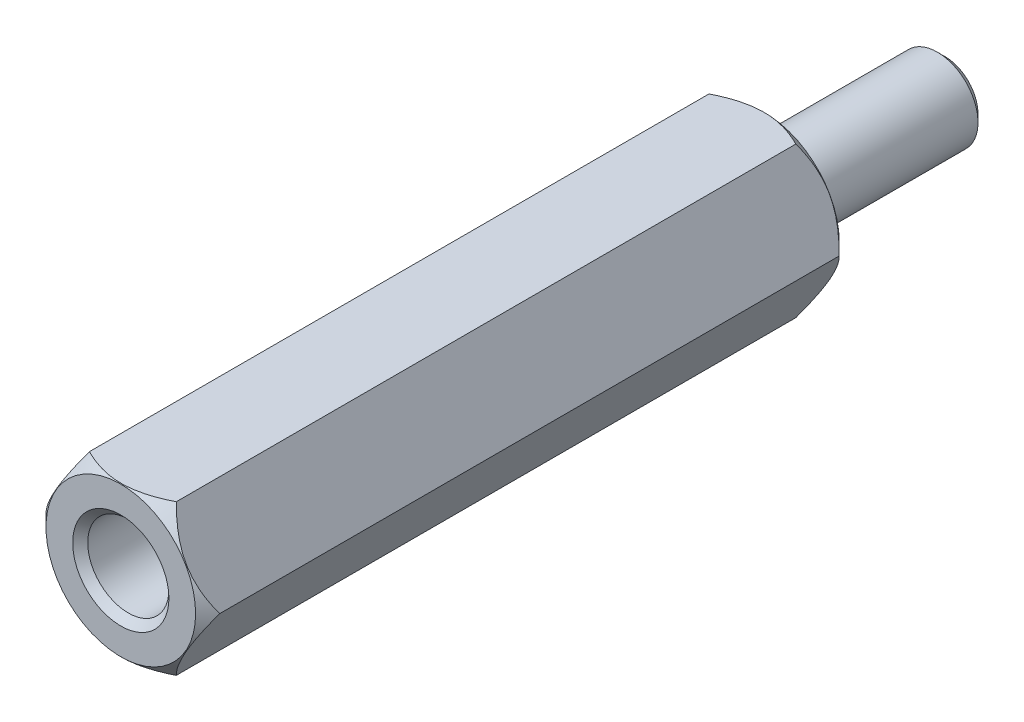
from build123d import *

# Parameters (mm, degrees)
HEX_2_DEPTH                 = 10.7
TAP_DRILL_FOR_M3X0_5_TAP1_D = 2.7
THREAD_DEPTH                = 6
THREAD_DEPTH_BACK           = 2
SKETCH8_R                   = 1.35
INNERCHAMFER_SIZE           = 0.25


with BuildPart() as part:
    # Sketch1 → HEX 2 (new, symmetric)
    with BuildSketch(Plane.XY):
        Polygon((2.886751346, 0), (1.443375673, 2.5), (-1.443375673, 2.5), (-2.886751346, 0), (-1.443375673, -2.5), (1.443375673, -2.5), align=None)
    extrude(amount=HEX_2_DEPTH, both=True)

    # Tap Drill for M3x0.5 Tap1 (through all)
    with Locations(Plane.XY.offset(10.7)):
        with Locations((0, 0)):
            Hole(TAP_DRILL_FOR_M3X0_5_TAP1_D / 2)

    # Sketch7 → HexChamfer (revolve, cut)
    with BuildSketch(Plane(origin=(0, 0, 0), x_dir=(1, 0, 0), z_dir=(0, 1, 0)), mode=Mode.PRIVATE) as hexchamfer_sk:
        Polygon((-2.886751346, 10.7), (-2.886751346, 10.3), (-2.486751346, 10.7), align=None)
    hexchamfer = revolve(hexchamfer_sk.sketch.rotate(Axis((0, 0, 15.266742202), (0, 0, -1)), 180), axis=Axis((0, 0, 15.266742202), (0, 0, -1)), mode=Mode.SUBTRACT)

    # Mirror1: HexChamfer across plane
    add(hexchamfer.mirror(Plane.XY), mode=Mode.SUBTRACT)

    # Sketch8 → Thread (add, two sides: drawn at the far end of the back side and taken through both)
    with BuildSketch(Plane(origin=(0, 0, -10.7), x_dir=(-1, 0, 0), z_dir=(0, 0, -1)).offset(-THREAD_DEPTH_BACK)):
        with Locations(Location((0, 0, 0), (0, 0, 180))):
            Circle(SKETCH8_R)
    extrude(amount=THREAD_DEPTH + THREAD_DEPTH_BACK)

    # InnerChamfer
    innerchamfer_edges = [part.edges().sort_by_distance(p)[0] for p in [
        (1.35, 0, 10.7),
        (-1.35, 0, -10.7),
        (-1.35, 0, -16.7),
    ]]
    chamfer(innerchamfer_edges, length=INNERCHAMFER_SIZE)


solid = part.part
